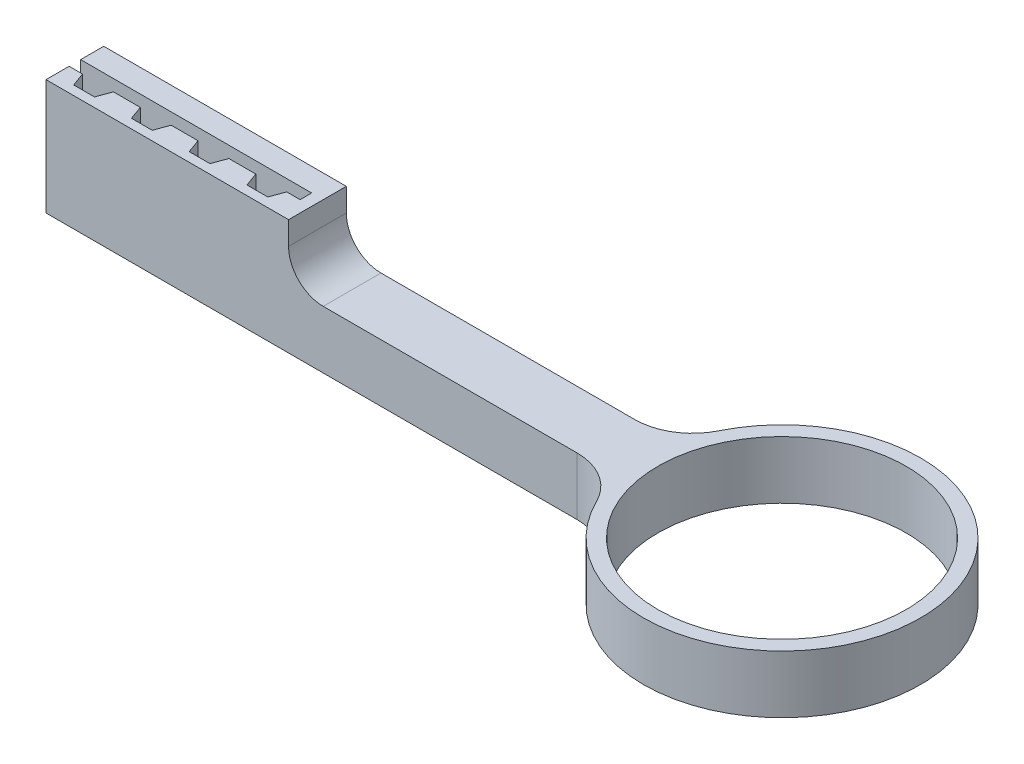
from build123d import *

# Parameters (mm, degrees)
SKETCH_1_R               = 12
SKETCH_1_R_2             = 10.75
RING_DEPTH               = 5
SKETCH_2_W               = 50
SKETCH_2_H               = 5
STICK_DEPTH              = 5
SKETCH_3_W               = 21
SKETCH_3_H               = 5
KEY_DEPTH                = 10
FILLET_1_R               = 5
FILLET_5_R               = 3
CUT_EXTRUDE_1_DEPTH      = 63.839058045
CUT_EXTRUDE_1_DEPTH_BACK = 63.839058045


with BuildPart() as part:
    # Эскиз1 → ring (new body)
    with BuildSketch(Plane(origin=(0, 0, 0), x_dir=(1, 0, 0), z_dir=(0, 1, 0))):
        with Locations(Location((0, 0, 0), (0, 0, 270))):
            Circle(SKETCH_1_R)
        with Locations(Location((0, 0, 0), (0, 0, 270))):
            Circle(SKETCH_1_R_2, mode=Mode.SUBTRACT)
    extrude(amount=RING_DEPTH)

    # Эскиз2 → stick (add)
    with BuildSketch(Plane(origin=(0, 0, 0), x_dir=(1, 0, 0), z_dir=(0, 1, 0))):
        with Locations((-36.22497216, 0)):
            Rectangle(SKETCH_2_W, SKETCH_2_H)
    extrude(amount=STICK_DEPTH)

    # Эскиз3 → key (add)
    with BuildSketch(Plane(origin=(0, 0, 0), x_dir=(1, 0, 0), z_dir=(0, 1, 0))):
        with Locations((-50.72497216, 0)):
            Rectangle(SKETCH_3_W, SKETCH_3_H)
    extrude(amount=KEY_DEPTH)

    # Скругление1
    fillet_1_edges = [part.edges().sort_by_distance(p)[0] for p in [
        (-11.736694594, 2.5, 2.5),
        (-11.736694594, 2.5, -2.5),
    ]]
    fillet(fillet_1_edges, radius=FILLET_1_R)

    # Скругление5
    fillet_5_edges = [part.edges().sort_by_distance(p)[0] for p in [
        (-40.22497216, 5, 0),
    ]]
    fillet(fillet_5_edges, radius=FILLET_5_R)

    # Эскиз4 → Вытянуть1 (cut, two sides: drawn at the far end of the back side and taken through both)
    with BuildSketch(Plane(origin=(0, 2.5, 0), x_dir=(1, 0, 0), z_dir=(0, 1, 0)).offset(-CUT_EXTRUDE_1_DEPTH_BACK)):
        Polygon((-61.22497216, 0.5), (-41.22497216, 0.5), (-41.22497216, -0.5), (-42.388207879, -0.5), (-42.82497216, -1.7), (-44.62497216, -1.7), (-45.061736441, -0.5), (-46.22497216, -0.5), (-47.388207879, -0.5), (-47.82497216, -1.7), (-49.62497216, -1.7), (-50.061736441, -0.5), (-51.22497216, -0.5), (-52.388207879, -0.5), (-52.82497216, -1.7), (-54.62497216, -1.7), (-55.061736441, -0.5), (-56.22497216, -0.5), (-57.388207879, -0.5), (-57.82497216, -1.7), (-59.62497216, -1.7), (-60.061736441, -0.5), (-61.22497216, -0.5), align=None)
    extrude(amount=CUT_EXTRUDE_1_DEPTH + CUT_EXTRUDE_1_DEPTH_BACK, mode=Mode.SUBTRACT)


solid = part.part
